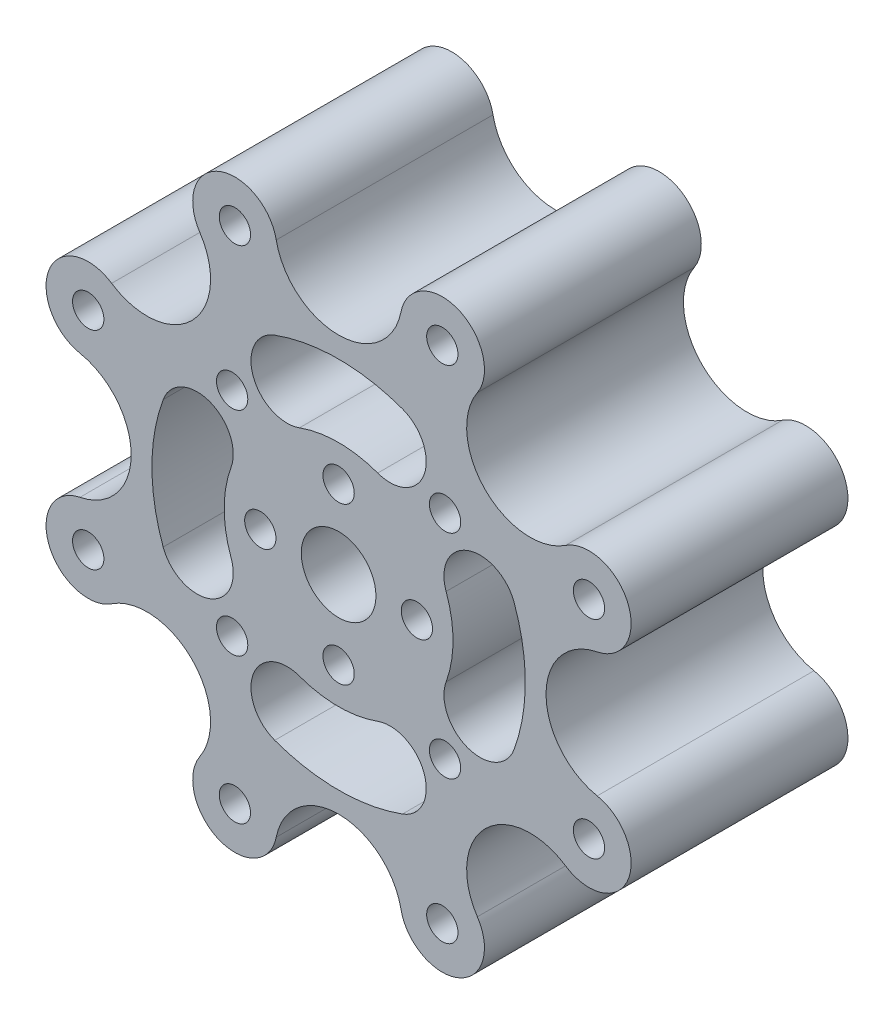
from build123d import *

# Parameters (mm, degrees)
SKETCH_1_R          = 1.3
SKETCH_1_R_2        = 3
SKETCH_1_R_3        = 3.1
EXTRUDE_1_DEPTH     = 18
CUT_EXTRUDE_1_DEPTH = 39.778149269


with BuildPart() as part:
    # ｽｹｯﾁ1 → ﾎﾞｽ - 押し出し1 (new body)
    with BuildSketch(Plane.XY):
        with BuildLine():
            ThreePointArc((11.520520871, 18.842793666), (9.949769241, 24.020867845), (5.177628747, 21.470105609))
            ThreePointArc((5.177628747, 21.470105609), (0, 17.220935509), (-5.177628747, 21.470105609))
            ThreePointArc((-5.177628747, 21.470105609), (-9.949769241, 24.020867845), (-11.520520871, 18.842793666))
            ThreePointArc((-11.520520871, 18.842793666), (-12.177040277, 12.177040277), (-18.842793666, 11.520520871))
            ThreePointArc((-18.842793666, 11.520520871), (-24.020867845, 9.949769241), (-21.470105609, 5.177628747))
            ThreePointArc((-21.470105609, 5.177628747), (-17.220935509, 0), (-21.470105609, -5.177628747))
            ThreePointArc((-21.470105609, -5.177628747), (-24.020867845, -9.949769241), (-18.842793666, -11.520520871))
            ThreePointArc((-18.842793666, -11.520520871), (-12.177040277, -12.177040277), (-11.520520871, -18.842793666))
            ThreePointArc((-11.520520871, -18.842793666), (-9.949769241, -24.020867845), (-5.177628747, -21.470105609))
            ThreePointArc((-5.177628747, -21.470105609), (0, -17.220935509), (5.177628747, -21.470105609))
            ThreePointArc((5.177628747, -21.470105609), (9.949769241, -24.020867845), (11.520520871, -18.842793666))
            ThreePointArc((11.520520871, -18.842793666), (12.177040277, -12.177040277), (18.842793666, -11.520520871))
            ThreePointArc((18.842793666, -11.520520871), (24.020867845, -9.949769241), (21.470105609, -5.177628747))
            ThreePointArc((21.470105609, -5.177628747), (17.220935509, 0), (21.470105609, 5.177628747))
            ThreePointArc((21.470105609, 5.177628747), (24.020867845, 9.949769241), (18.842793666, 11.520520871))
            ThreePointArc((18.842793666, 11.520520871), (12.177040277, 12.177040277), (11.520520871, 18.842793666))
        make_face()
        with Locations((8.610377228, 20.787289482)):
            Circle(SKETCH_1_R, mode=Mode.SUBTRACT)
        with Locations((20.787289482, 8.610377228)):
            Circle(SKETCH_1_R, mode=Mode.SUBTRACT)
        with Locations((20.787289482, -8.610377228)):
            Circle(SKETCH_1_R, mode=Mode.SUBTRACT)
        with Locations((8.610377228, -20.787289482)):
            Circle(SKETCH_1_R, mode=Mode.SUBTRACT)
        with Locations((-8.610377228, -20.787289482)):
            Circle(SKETCH_1_R, mode=Mode.SUBTRACT)
        with Locations((-20.787289482, -8.610377228)):
            Circle(SKETCH_1_R, mode=Mode.SUBTRACT)
        with Locations((-20.787289482, 8.610377228)):
            Circle(SKETCH_1_R, mode=Mode.SUBTRACT)
        with Locations((-8.610377228, 20.787289482)):
            Circle(SKETCH_1_R, mode=Mode.SUBTRACT)
        with Locations((8.838834765, 8.838834765)):
            Circle(SKETCH_1_R, mode=Mode.SUBTRACT)
        with Locations((8.838834765, -8.838834765)):
            Circle(SKETCH_1_R, mode=Mode.SUBTRACT)
        with Locations((-8.838834765, -8.838834765)):
            Circle(SKETCH_1_R, mode=Mode.SUBTRACT)
        with Locations((-8.838834765, 8.838834765)):
            Circle(SKETCH_1_R, mode=Mode.SUBTRACT)
        with Locations((0, 6.5)):
            Circle(SKETCH_1_R, mode=Mode.SUBTRACT)
        with Locations((6.5, 0)):
            Circle(SKETCH_1_R, mode=Mode.SUBTRACT)
        with Locations((0, -6.5)):
            Circle(SKETCH_1_R, mode=Mode.SUBTRACT)
        with Locations((-6.5, 0)):
            Circle(SKETCH_1_R, mode=Mode.SUBTRACT)
        with Locations((0, 12.5)):
            Circle(SKETCH_1_R_2, mode=Mode.SUBTRACT)
        with Locations((12.5, 0)):
            Circle(SKETCH_1_R_2, mode=Mode.SUBTRACT)
        with Locations((0, -12.5)):
            Circle(SKETCH_1_R_2, mode=Mode.SUBTRACT)
        with Locations((-12.5, 0)):
            Circle(SKETCH_1_R_2, mode=Mode.SUBTRACT)
        Circle(SKETCH_1_R_3, mode=Mode.SUBTRACT)
    extrude(amount=EXTRUDE_1_DEPTH)

    # ｽｹｯﾁ2 → ｶｯﾄ - 押し出し1 (cut, through all)
    with BuildSketch(Plane.XY.offset(18)):
        with BuildLine():
            ThreePointArc((-15.5, 6e-09), (-12.499999997, 3), (-9.5, 0))
            ThreePointArc((-9.5, 0), (-9.355673654, 1.649657688), (-8.927079897, 3.249191362))
            ThreePointArc((-8.927079897, 3.249191362), (-10.72009733, 7.094329654), (-14.565235622, 5.301312222))
            ThreePointArc((-14.565235622, 5.301312222), (-15.264520171, 2.691546757), (-15.5, 6e-09))
        make_face()
        with BuildLine():
            ThreePointArc((-14.565235622, -5.301312222), (-10.72009733, -7.094329654), (-8.927079897, -3.249191362))
            ThreePointArc((-8.927079897, -3.249191362), (-9.355673654, -1.649657688), (-9.5, 0))
            ThreePointArc((-9.5, 0), (-12.500000003, -3), (-15.5, 6e-09))
            ThreePointArc((-15.5, 6e-09), (-15.264520172, -2.691546751), (-14.565235622, -5.301312222))
        make_face()
        with BuildLine():
            ThreePointArc((5.301312222, -14.565235622), (7.094329654, -10.72009733), (3.249191362, -8.927079897))
            ThreePointArc((3.249191362, -8.927079897), (1.649657689, -9.355673653), (3e-09, -9.5))
            ThreePointArc((3e-09, -9.5), (2.121320344, -10.378679657), (3, -12.5))
            ThreePointArc((3, -12.5), (2.121320344, -14.621320343), (1e-09, -15.5))
            ThreePointArc((1e-09, -15.5), (2.691546754, -15.264520172), (5.301312222, -14.565235622))
        make_face()
        with BuildLine():
            ThreePointArc((1e-09, -15.5), (-3, -12.499999999), (3e-09, -9.5))
            ThreePointArc((3e-09, -9.5), (-1.649657687, -9.355673654), (-3.249191362, -8.927079897))
            ThreePointArc((-3.249191362, -8.927079897), (-7.094329654, -10.72009733), (-5.301312222, -14.565235622))
            ThreePointArc((-5.301312222, -14.565235622), (-2.691546753, -15.264520172), (1e-09, -15.5))
        make_face()
        with BuildLine():
            ThreePointArc((15.5, 0), (12.499999993, -3), (9.5, 1.5e-08))
            ThreePointArc((9.5, 1.5e-08), (9.355673655, -1.649657681), (8.927079897, -3.249191362))
            ThreePointArc((8.927079897, -3.249191362), (10.72009733, -7.094329654), (14.565235622, -5.301312222))
            ThreePointArc((14.565235622, -5.301312222), (15.264520172, -2.691546754), (15.5, 0))
        make_face()
        with BuildLine():
            ThreePointArc((14.565235622, 5.301312222), (10.72009733, 7.094329654), (8.927079897, 3.249191362))
            ThreePointArc((8.927079897, 3.249191362), (9.355673652, 1.649657695), (9.5, 1.5e-08))
            ThreePointArc((9.5, 1.5e-08), (12.500000007, 3), (15.5, 0))
            ThreePointArc((15.5, 0), (15.264520172, 2.691546754), (14.565235622, 5.301312222))
        make_face()
        with BuildLine():
            ThreePointArc((-1.5e-08, 9.5), (1.649657681, 9.355673655), (3.249191362, 8.927079897))
            ThreePointArc((3.249191362, 8.927079897), (7.094329654, 10.72009733), (5.301312222, 14.565235622))
            ThreePointArc((5.301312222, 14.565235622), (2.691546753, 15.264520172), (-1e-09, 15.5))
            ThreePointArc((-1e-09, 15.5), (2.121320343, 14.621320344), (3, 12.5))
            ThreePointArc((3, 12.5), (2.121320338, 10.378679651), (-1.5e-08, 9.5))
        make_face()
        with BuildLine():
            ThreePointArc((-3.249191362, 8.927079897), (-1.649657695, 9.355673652), (-1.5e-08, 9.5))
            ThreePointArc((-1.5e-08, 9.5), (-3, 12.500000007), (-1e-09, 15.5))
            ThreePointArc((-1e-09, 15.5), (-2.691546754, 15.264520172), (-5.301312222, 14.565235622))
            ThreePointArc((-5.301312222, 14.565235622), (-7.094329654, 10.72009733), (-3.249191362, 8.927079897))
        make_face()
    extrude(amount=-CUT_EXTRUDE_1_DEPTH, mode=Mode.SUBTRACT)


solid = part.part
